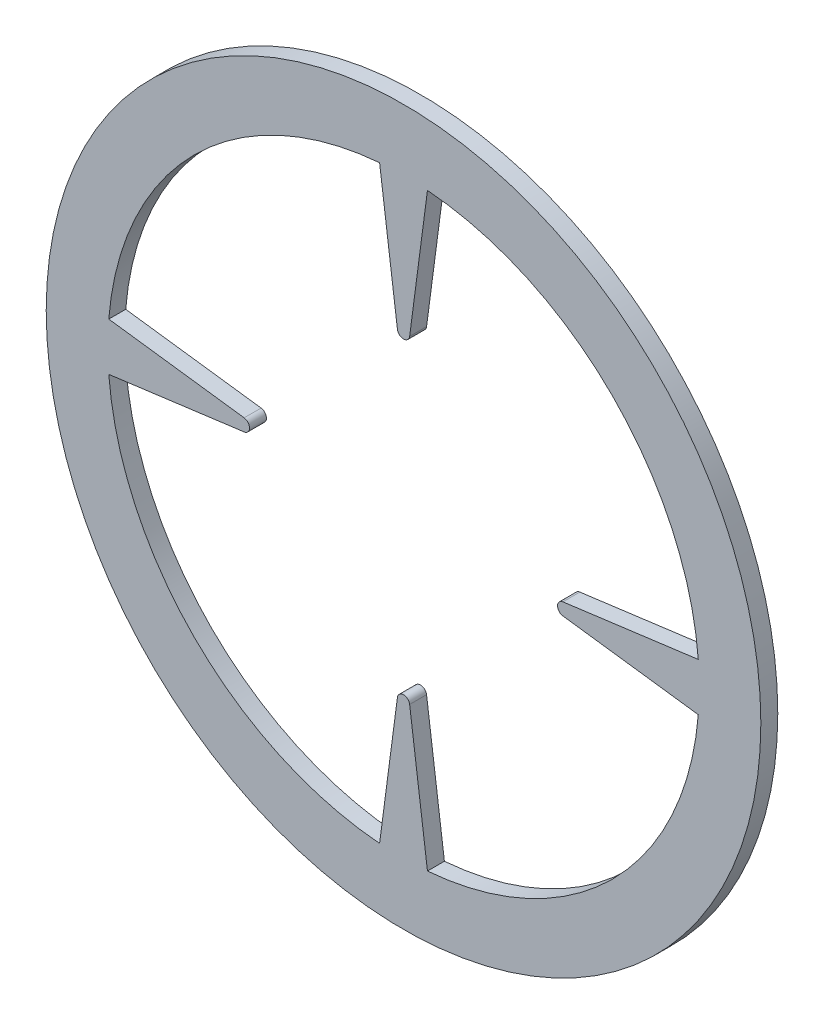
from build123d import *

# Parameters (mm, degrees)
SKETCH_1_R      = 1.16
SKETCH_1_R_2    = 0.96
EXTRUDE_1_DEPTH = 0.055
EXTRUDE_START   = -0.055
SKETCH_2_R      = 0.02
EXTRUDE_2_DEPTH = 0.055


with BuildPart() as part:
    # 草圖1 → 填料-伸長1 (new body)
    with BuildSketch(Plane.XY):
        Circle(SKETCH_1_R)
        Circle(SKETCH_1_R_2, mode=Mode.SUBTRACT)
    extrude(amount=EXTRUDE_1_DEPTH)

    # 草圖2 → 填料-伸長2 (add)
    with BuildSketch(Plane.XY.offset(0.055).offset(EXTRUDE_START)):
        with BuildLine():
            Line((-0.077685185, 0.956851614), (-0.019828897, 0.517389476))
            ThreePointArc((-0.019828897, 0.517389476), (-0.001308063, 0.539957178), (0.02, 0.52))
            ThreePointArc((0.02, 0.52), (0.019957178, 0.518691937), (0.019828897, 0.517389476))
            Line((0.019828897, 0.517389476), (0.077685185, 0.956851614))
            ThreePointArc((0.077685185, 0.956851614), (0, 0.96), (-0.077685185, 0.956851614))
        make_face()
        with BuildLine():
            ThreePointArc((0.96, 0), (0.959212581, 0.038874479), (0.956851614, 0.077685185))
            Line((0.956851614, 0.077685185), (0.517389476, 0.019828897))
            ThreePointArc((0.517389476, 0.019828897), (0.533186916, 0.015036796), (0.54, 0))
            ThreePointArc((0.54, 0), (0.533186916, -0.015036796), (0.517389476, -0.019828897))
            Line((0.517389476, -0.019828897), (0.956851614, -0.077685185))
            ThreePointArc((0.956851614, -0.077685185), (0.959212581, -0.038874479), (0.96, 0))
        make_face()
        with BuildLine():
            Line((-0.019828897, -0.517389476), (-0.077685185, -0.956851614))
            ThreePointArc((-0.077685185, -0.956851614), (0, -0.96), (0.077685185, -0.956851614))
            Line((0.077685185, -0.956851614), (0.019828897, -0.517389476))
            ThreePointArc((0.019828897, -0.517389476), (0.019957178, -0.518691937), (0.02, -0.52))
            ThreePointArc((0.02, -0.52), (-0.001308063, -0.539957178), (-0.019828897, -0.517389476))
        make_face()
        with BuildLine():
            Line((-0.517389476, 0.019828897), (-0.956851614, 0.077685185))
            ThreePointArc((-0.956851614, 0.077685185), (-0.96, 0), (-0.956851614, -0.077685185))
            Line((-0.956851614, -0.077685185), (-0.517389476, -0.019828897))
            ThreePointArc((-0.517389476, -0.019828897), (-0.54, 0), (-0.517389476, 0.019828897))
        make_face()
        with Locations((0, 0.52)):
            Circle(SKETCH_2_R)
        with Locations((0.52, 0)):
            Circle(SKETCH_2_R)
        with Locations((0, -0.52)):
            Circle(SKETCH_2_R)
        with Locations((-0.52, 0)):
            Circle(SKETCH_2_R)
    extrude(amount=EXTRUDE_2_DEPTH)


solid = part.part
